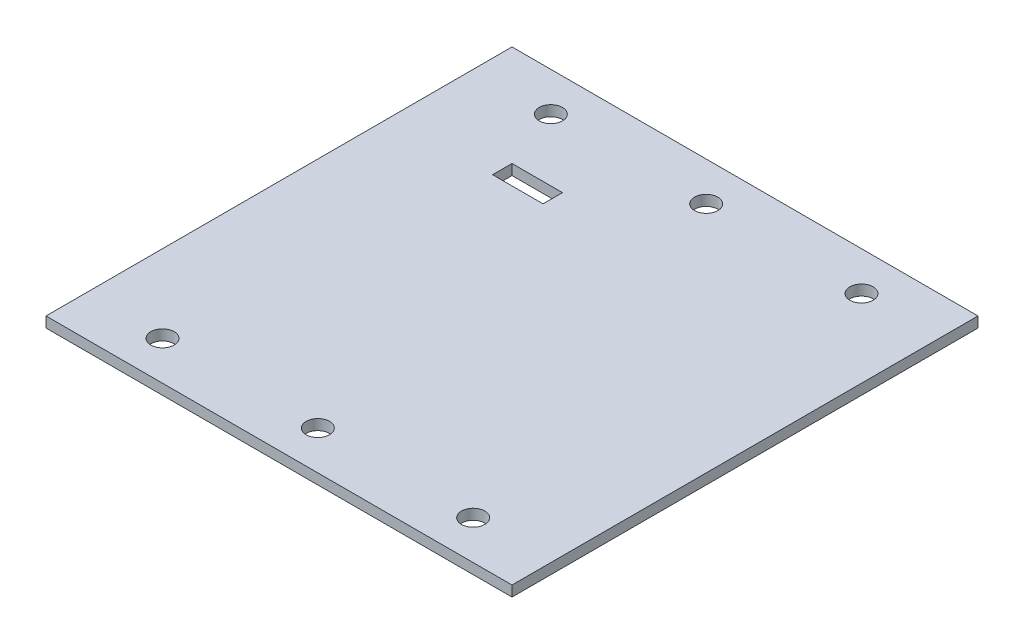
from build123d import *

# Parameters (mm, degrees)
CROQUIS2_W              = 120
CROQUIS2_H              = 120
SALIENTE_EXTRUIR2_DEPTH = 2.7
CROQUIS3_R              = 3
CORTAR_EXTRUIR1_DEPTH   = 85.895759611
CROQUIS4_W              = 13
CROQUIS4_H              = 5
CORTAR_EXTRUIR2_DEPTH   = 2.7


with BuildPart() as part:
    # Croquis2 → Saliente-Extruir2 (new body)
    with BuildSketch(Plane(origin=(0, 0, 0), x_dir=(1, 0, 0), z_dir=(0, 1, 0))):
        Rectangle(CROQUIS2_W, CROQUIS2_H)
    extrude(amount=SALIENTE_EXTRUIR2_DEPTH)

    # Croquis3 → Cortar-Extruir1 (cut, through all)
    with BuildSketch(Plane(origin=(0, 2.7, 0), x_dir=(1, 0, 0), z_dir=(0, 1, 0))):
        with Locations(Location((0, 50, 0), (0, 0, 270))):
            Circle(CROQUIS3_R)
        with Locations(Location((40, 50, 0), (0, 0, 270))):
            Circle(CROQUIS3_R)
        with Locations(Location((-40, 50, 0), (0, 0, 270))):
            Circle(CROQUIS3_R)
        with Locations(Location((-40, -50, 0), (0, 0, 270))):
            Circle(CROQUIS3_R)
        with Locations(Location((40, -50, 0), (0, 0, 270))):
            Circle(CROQUIS3_R)
        with Locations(Location((0, -50, 0), (0, 0, 270))):
            Circle(CROQUIS3_R)
    extrude(amount=-CORTAR_EXTRUIR1_DEPTH, mode=Mode.SUBTRACT)

    # Croquis4 → Cortar-Extruir2 (cut)
    with BuildSketch(Plane.XZ):
        with Locations((-27.5, -31.5)):
            Rectangle(CROQUIS4_W, CROQUIS4_H)
    extrude(amount=-CORTAR_EXTRUIR2_DEPTH, mode=Mode.SUBTRACT)


solid = part.part
